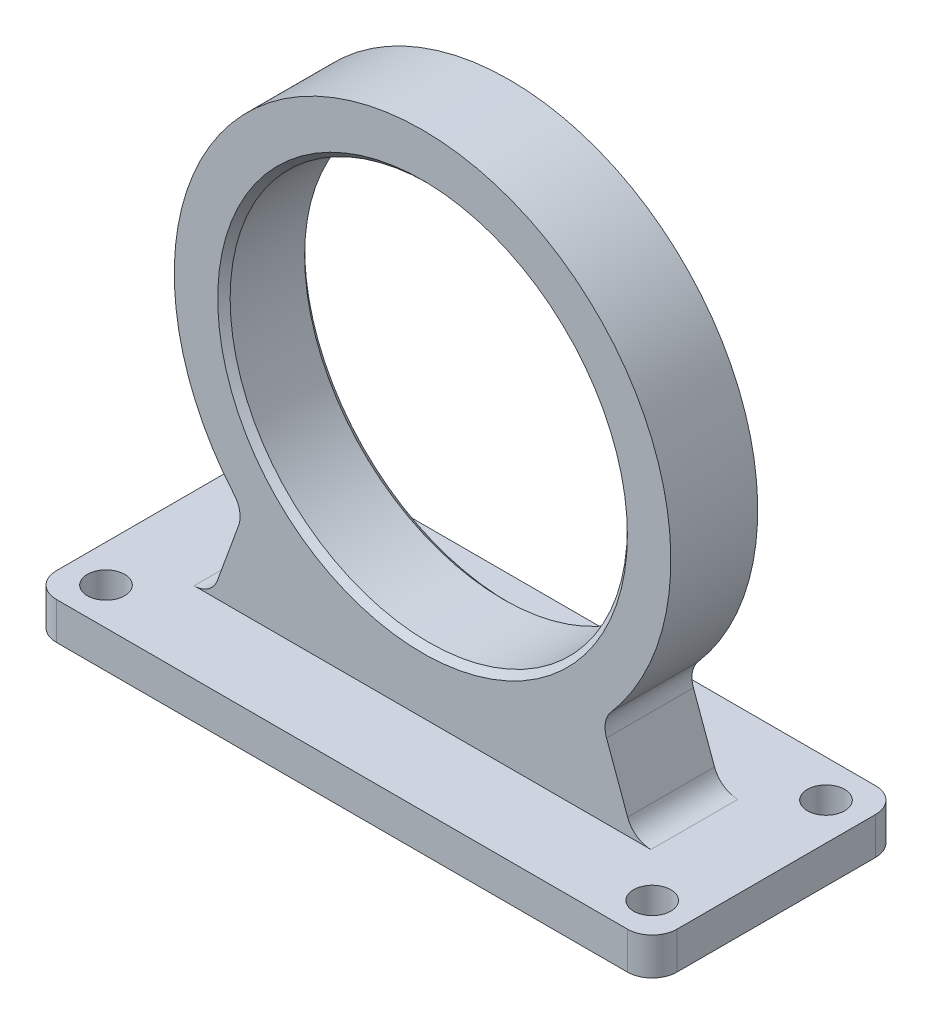
from build123d import *

# Parameters (mm, degrees)
SKETCH_1_R      = 16
EXTRUDE_1_DEPTH = 3.5
SKETCH_2_W      = 50
SKETCH_2_H      = 20
SKETCH_2_R      = 1.5
EXTRUDE_2_DEPTH = 3
FILLET_1_R      = 2
FILLET_2_R      = 2
CHAMFER_1_SIZE  = 0.5


with BuildPart() as part:
    # 草图1 → 凸台-拉伸1 (new, symmetric)
    with BuildSketch(Plane.XY):
        with BuildLine():
            Line((17, 3), (14.406055462, 10.126804045))
            ThreePointArc((14.406055462, 10.126804045), (0, 44), (-14.406055462, 10.126804045))
            Line((-14.406055462, 10.126804045), (-17, 3))
            Line((-17, 3), (-25, 3))
            Line((-25, 3), (-25, 0))
            Line((-25, 0), (25, 0))
            Line((25, 0), (25, 3))
            Line((25, 3), (17, 3))
        make_face()
        with Locations((0, 24)):
            Circle(SKETCH_1_R, mode=Mode.SUBTRACT)
    extrude(amount=EXTRUDE_1_DEPTH, both=True)

    # 草图2 → 凸台-拉伸2 (add)
    with BuildSketch(Plane.XZ):
        Rectangle(SKETCH_2_W, SKETCH_2_H)
        with Locations(Location((-22, -7, 0), (0, 0, 270))):
            Circle(SKETCH_2_R, mode=Mode.SUBTRACT)
        with Locations(Location((22, -7, 0), (0, 0, 270))):
            Circle(SKETCH_2_R, mode=Mode.SUBTRACT)
        with Locations(Location((22, 7, 0), (0, 0, 270))):
            Circle(SKETCH_2_R, mode=Mode.SUBTRACT)
        with Locations(Location((-22, 7, 0), (0, 0, 270))):
            Circle(SKETCH_2_R, mode=Mode.SUBTRACT)
    extrude(amount=-EXTRUDE_2_DEPTH)

    # 圆角1
    fillet_1_edges = [part.edges().sort_by_distance(p)[0] for p in [
        (14.406055462, 10.126804045, 0),
        (17, 3, 0),
        (-17, 3, 0),
        (-14.406055462, 10.126804045, 0),
    ]]
    fillet(fillet_1_edges, radius=FILLET_1_R)

    # 圆角2
    fillet_2_edges = [part.edges().sort_by_distance(p)[0] for p in [
        (-25, 1.5, 10),
        (25, 1.5, 10),
        (-25, 1.5, -10),
        (25, 1.5, -10),
    ]]
    fillet(fillet_2_edges, radius=FILLET_2_R)

    # 倒角1
    chamfer_1_edges = [part.edges().sort_by_distance(p)[0] for p in [
        (-16, 24, -3.5),
        (-16, 24, 3.5),
    ]]
    chamfer(chamfer_1_edges, length=CHAMFER_1_SIZE)


solid = part.part
